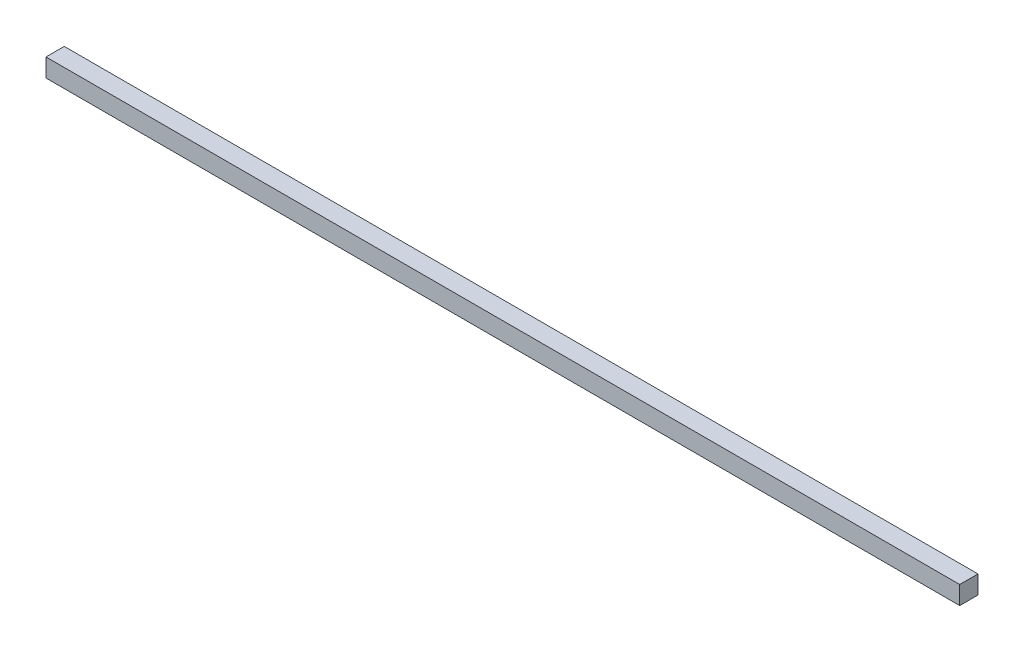
from build123d import *

# Parameters (mm, degrees)
SKETCH2_W           = 1000
SKETCH2_H           = 20
BOSS_EXTRUDE1_DEPTH = 20


with BuildPart() as part:
    # Sketch2 → Boss-Extrude1 (new body)
    with BuildSketch(Plane(origin=(0, 0, 0), x_dir=(1, 0, 0), z_dir=(0, 1, 0))):
        with Locations((500, 10)):
            Rectangle(SKETCH2_W, SKETCH2_H)
    extrude(amount=BOSS_EXTRUDE1_DEPTH)


solid = part.part
